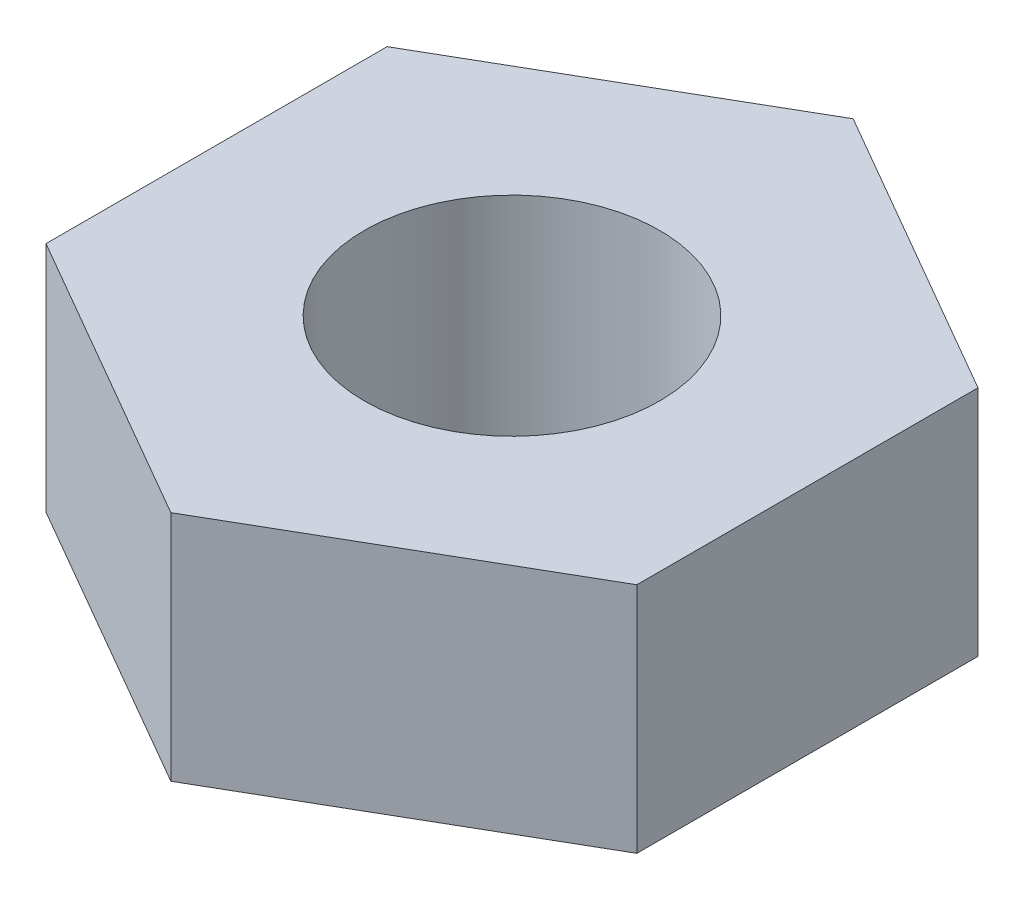
from build123d import *

# Parameters (mm, degrees)
BOSS_EXTRUDE1_DEPTH = 5
SKETCH3_R           = 6.35
CUT_EXTRUDE1_DEPTH  = 22.82529114


with BuildPart() as part:
    # Sketch2 → Boss-Extrude1 (new, symmetric)
    with BuildSketch(Plane(origin=(0, 0, 0), x_dir=(1, 0, 0), z_dir=(0, 1, 0))):
        Polygon((12.7, 7.332348419), (0, 14.664696837), (-12.7, 7.332348419), (-12.7, -7.332348419), (0, -14.664696837), (12.7, -7.332348419), align=None)
    extrude(amount=BOSS_EXTRUDE1_DEPTH, both=True)

    # Sketch3 → Cut-Extrude1 (cut, through all)
    with BuildSketch(Plane(origin=(0, 5, 0), x_dir=(1, 0, 0), z_dir=(0, 1, 0))):
        with Locations(Location((0, 0, 0), (0, 0, 270))):
            Circle(SKETCH3_R)
    extrude(amount=-CUT_EXTRUDE1_DEPTH, mode=Mode.SUBTRACT)


solid = part.part
